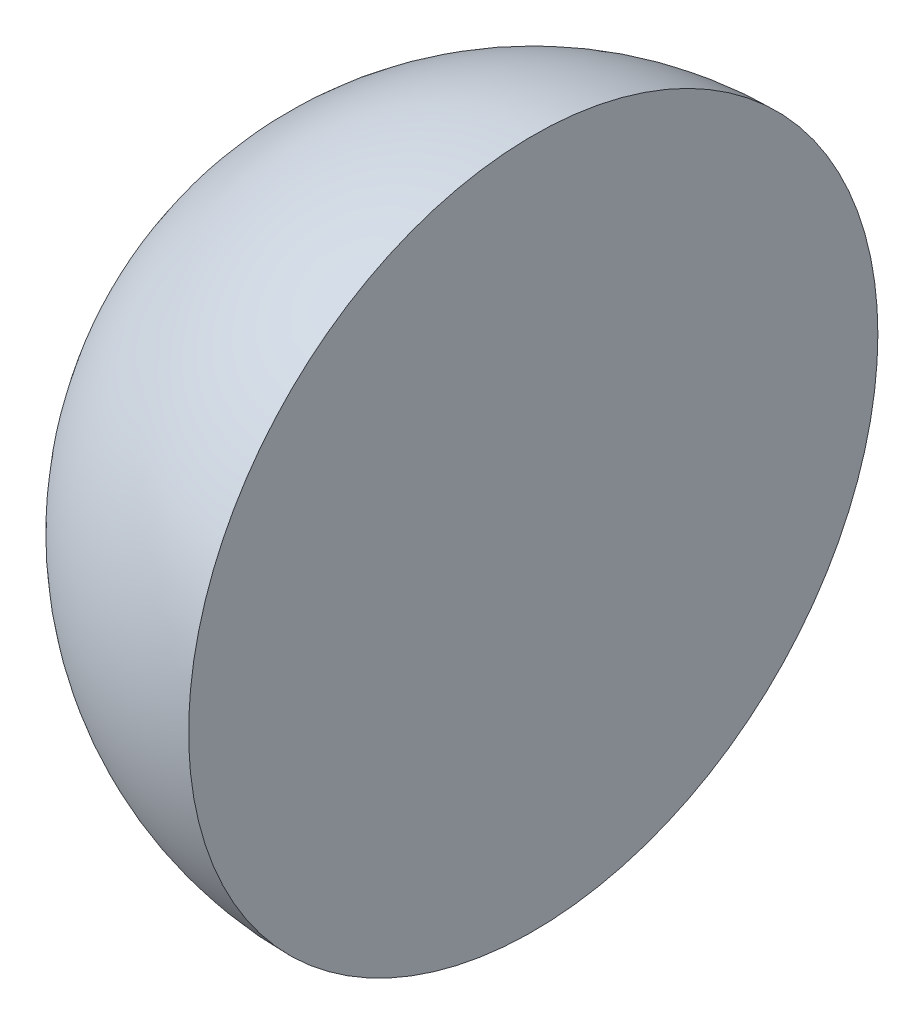
from build123d import *

# Parameters (mm, degrees)
SKETCH2_W          = 295.320100422
SKETCH2_H          = 328.051337738
CUT_EXTRUDE1_DEPTH = 95.25


with BuildPart() as part:
    # Sketch1 → Revolve1 (revolve)
    with BuildSketch(Plane.XY):
        with BuildLine():
            Line((0, 153.180638981), (0, -37.319361019))
            ThreePointArc((0, -37.319361019), (95.25, 57.930638981), (0, 153.180638981))
        make_face()
    revolve(axis=Axis((0, 153.180638981, 0), (0, -1, 0)))

    # Sketch2 → Cut-Extrude1 (cut)
    with BuildSketch(Plane(origin=(0, 0, 0), x_dir=(0, 0, -1), z_dir=(1, 0, 0))):
        Rectangle(SKETCH2_W, SKETCH2_H)
    extrude(amount=CUT_EXTRUDE1_DEPTH, mode=Mode.SUBTRACT)


solid = part.part
